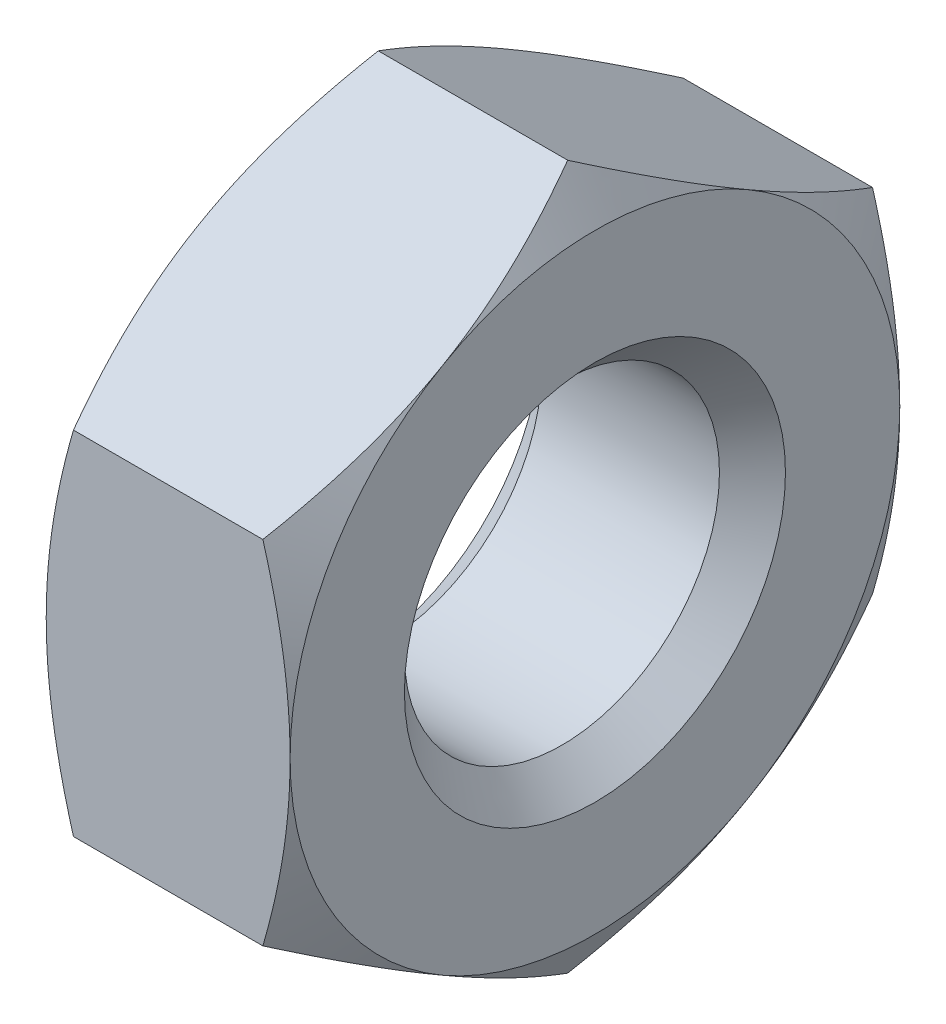
from build123d import *

# Parameters (mm, degrees)
CUT_EXTRUDE_1_DEPTH      = 3.2
CUT_EXTRUDE_1_DEPTH_BACK = 3.2
SKETCH_2_W               = 18.4
SKETCH_2_H               = 18.4


with BuildPart() as part:
    # 草图1 → 旋转1 (revolve)
    with BuildSketch(Plane.XY):
        Polygon((-1.6, 0), (-1.6, 4), (-1.138119785, 4.8), (1.138119785, 4.8), (1.6, 4), (1.6, 0), align=None)
    revolve(axis=Axis((1.6, 0, 0), (-1, 0, 0)))

    # 草图2 → 切除-拉伸1 (cut, two sides: drawn at the far end of the back side and taken through both)
    with BuildSketch(Plane(origin=(0, 0, 0), x_dir=(0, 0, -1), z_dir=(1, 0, 0)).offset(-CUT_EXTRUDE_1_DEPTH_BACK)):
        Rectangle(SKETCH_2_W, SKETCH_2_H)
        Polygon((-4, 2.309401077), (-4, -2.309401077), (0, -4.618802154), (4, -2.309401077), (4, 2.309401077), (0, 4.618802154), align=None, mode=Mode.SUBTRACT)
    extrude(amount=CUT_EXTRUDE_1_DEPTH + CUT_EXTRUDE_1_DEPTH_BACK, mode=Mode.SUBTRACT)

    # 草图3 → 切除-旋转1 (revolve, cut)
    with BuildSketch(Plane.XY):
        Polygon((-1.6, 0), (-1.6, 2.5), (-1.167, 2.067), (1.167, 2.067), (1.6, 2.5), (1.6, 0), align=None)
    revolve(axis=Axis((1.6, 0, 0), (-1, 0, 0)), mode=Mode.SUBTRACT)


solid = part.part
